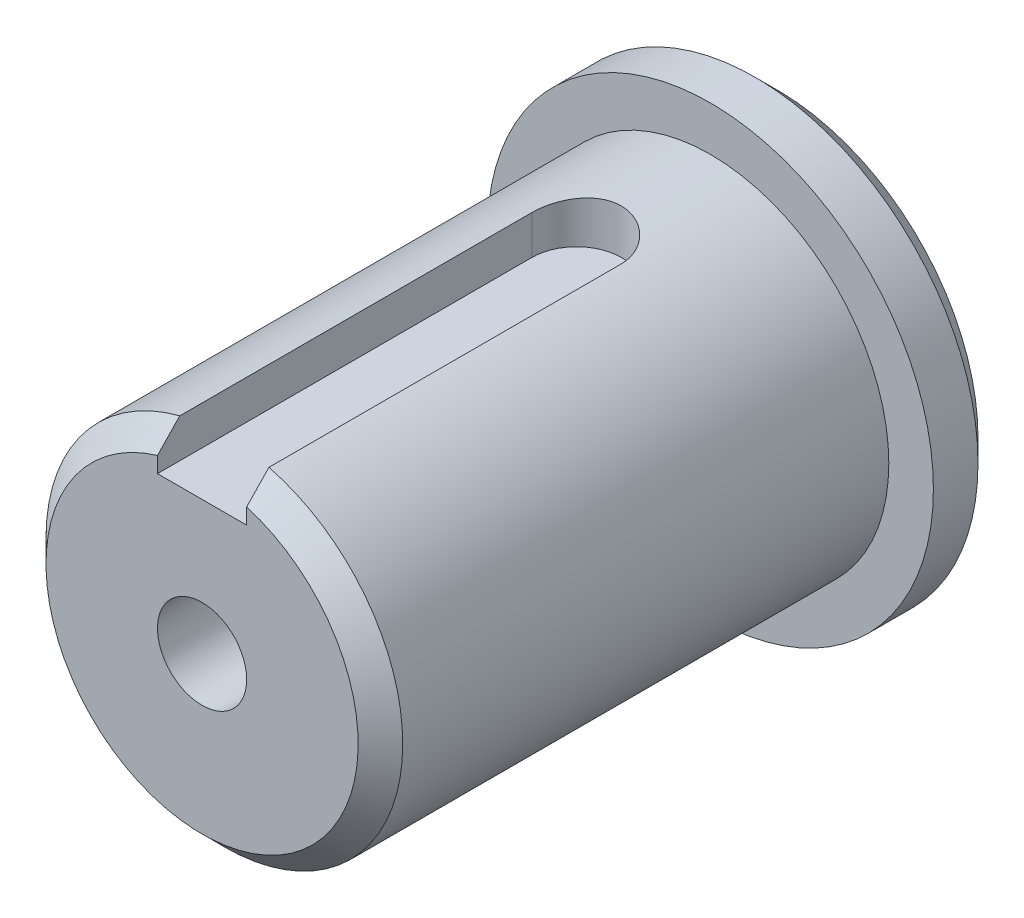
from build123d import *

# Parameters (mm, degrees)
CUT_EXTRUDE1_DEPTH = 1


with BuildPart() as part:
    # Sketch1 → Revolve1 (revolve)
    with BuildSketch(Plane(origin=(0, 0, 0), x_dir=(0, 0, -1), z_dir=(1, 0, 0)), mode=Mode.PRIVATE) as revolve1_sk:
        Polygon((0, 2.5), (0, 4.5), (-0.5, 5), (-1.5, 5), (-1.5, 4), (-12.4, 4), (-12.9, 3.5), (-12.9, 1), (-8, 1), (-8, 2.5), align=None)
    revolve(revolve1_sk.sketch.rotate(Axis((0, 0, 0), (0, 0, -1)), 90), axis=Axis((0, 0, 0), (0, 0, -1)))

    # Sketch2 → Cut-Extrude1 (cut)
    with BuildSketch(Plane(origin=(0, 4, 0), x_dir=(1, 0, 0), z_dir=(0, 1, 0))):
        with BuildLine():
            Line((-1, -12.9), (-1, -4.5))
            ThreePointArc((-1, -4.5), (0, -3.5), (1, -4.5))
            Line((1, -4.5), (1, -12.9))
            ThreePointArc((1, -12.9), (0, -13.9), (-1, -12.9))
        make_face()
    extrude(amount=-CUT_EXTRUDE1_DEPTH, mode=Mode.SUBTRACT)


solid = part.part
